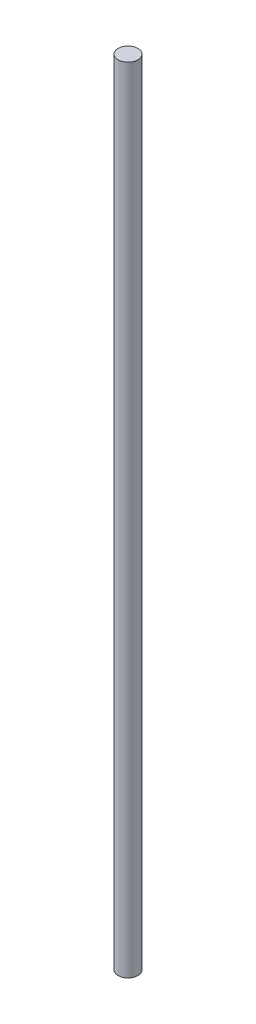
from build123d import *

# Parameters (mm, degrees)
SKETCH1_W = 5
SKETCH1_H = 400


with BuildPart() as part:
    # Sketch1 → Revolve1 (revolve)
    with BuildSketch(Plane.XY):
        with Locations((2.5, 200)):
            Rectangle(SKETCH1_W, SKETCH1_H)
    revolve(axis=Axis((0, 400, 0), (0, -1, 0)))


solid = part.part
